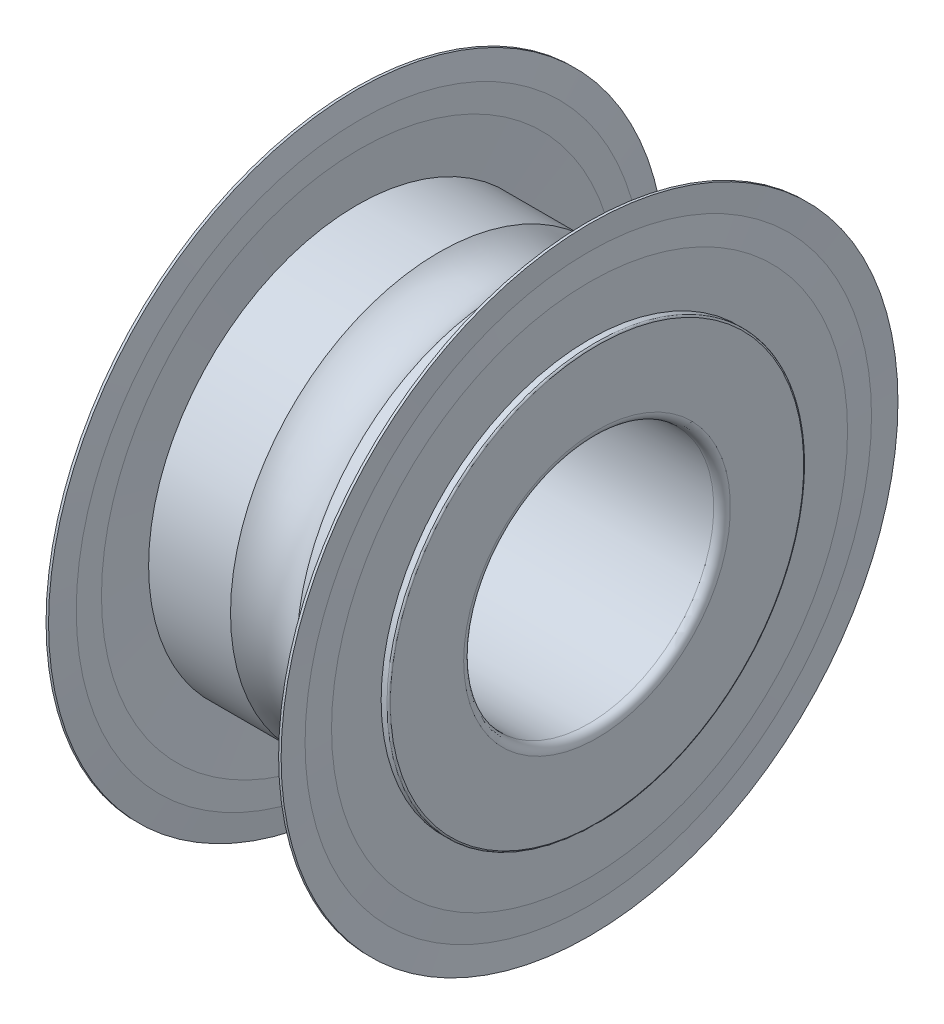
from build123d import *


with BuildPart() as part:
    # Sketch1 → Revolve1 (revolve)
    with BuildSketch(Plane.XY, mode=Mode.PRIVATE) as revolve1_sk:
        with BuildLine():
            Line((0, 2.48), (0, 1.6))
            ThreePointArc((0, 1.6), (0.029289322, 1.529289322), (0.1, 1.5))
            Line((0.1, 1.5), (2.9, 1.5))
            ThreePointArc((2.9, 1.5), (2.970710678, 1.529289322), (3, 1.6))
            Line((3, 1.6), (3, 2.48))
            ThreePointArc((3, 2.48), (2.994142136, 2.494142136), (2.98, 2.5))
            Line((2.98, 2.5), (1.896862697, 2.5))
            ThreePointArc((1.896862697, 2.5), (1.5, 2.35), (1.103137303, 2.5))
            Line((1.103137303, 2.5), (0.02, 2.5))
            ThreePointArc((0.02, 2.5), (0.005857864, 2.494142136), (0, 2.48))
        make_face()
    revolve(revolve1_sk.sketch.rotate(Axis((50, 0, 0), (-1, 0, 0)), 270), axis=Axis((50, 0, 0), (-1, 0, 0)))

    # Sketch2 → Revolve2 (revolve)
    with BuildSketch(Plane.XY, mode=Mode.PRIVATE) as revolve2_sk:
        Polygon((0.09, 3.7), (0.105, 3.3975), (0.09, 3.095), (0.09, 2.49), (0.12, 2.49), (0.15, 3.095), (0.15, 3.3975), (0.12, 3.7), align=None)
    revolve(revolve2_sk.sketch.rotate(Axis((50, 0, 0), (-1, 0, 0)), 270), axis=Axis((50, 0, 0), (-1, 0, 0)))

    # Sketch3 → Revolve3 (revolve)
    with BuildSketch(Plane.XY, mode=Mode.PRIVATE) as revolve3_sk:
        Polygon((2.85, 3.3975), (2.85, 3.095), (2.88, 2.49), (2.91, 2.49), (2.91, 3.095), (2.895, 3.3975), (2.91, 3.7), (2.88, 3.7), align=None)
    revolve(revolve3_sk.sketch.rotate(Axis((50, 0, 0), (-1, 0, 0)), 270), axis=Axis((50, 0, 0), (-1, 0, 0)))


solid = part.part
